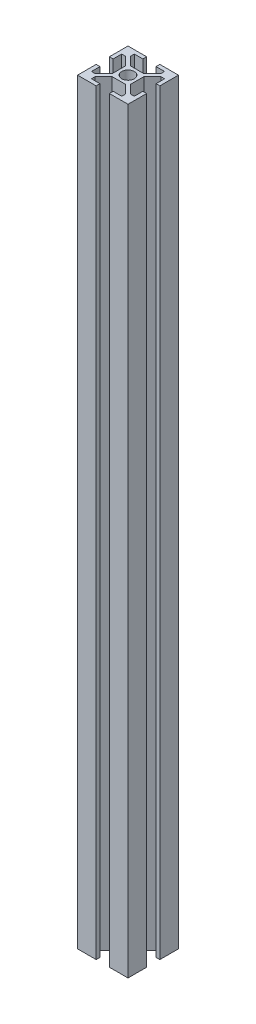
from build123d import *

# Parameters (mm, degrees)
SKETCH3_R           = 2.5
BOSS_EXTRUDE1_DEPTH = 300


with BuildPart() as part:
    # Sketch3 → Boss-Extrude1 (new body)
    with BuildSketch(Plane(origin=(0, 0, 0), x_dir=(1, 0, 0), z_dir=(0, 1, 0))):
        Polygon((2.594339828, 3.655), (6, 7.060660172), (6, 8.5), (2.63, 8.5), (2.63, 10), (10, 10), (10, 2.63), (8.5, 2.63), (8.5, 6), (7.060660172, 6), (3.655, 2.594339828), (3.655, 0), (3.655, -2.594339828), (7.060660172, -6), (8.5, -6), (8.5, -2.63), (10, -2.63), (10, -10), (2.63, -10), (2.63, -8.5), (6, -8.5), (6, -7.060660172), (2.594339828, -3.655), (0, -3.655), (-2.594339828, -3.655), (-6, -7.060660172), (-6, -8.5), (-2.63, -8.5), (-2.63, -10), (-10, -10), (-10, -2.63), (-8.5, -2.63), (-8.5, -6), (-7.060660172, -6), (-3.655, -2.594339828), (-3.655, 0), (-3.655, 2.594339828), (-7.060660172, 6), (-8.5, 6), (-8.5, 2.63), (-10, 2.63), (-10, 10), (-2.63, 10), (-2.63, 8.5), (-6, 8.5), (-6, 7.060660172), (-2.594339828, 3.655), (0, 3.655), align=None)
        Circle(SKETCH3_R, mode=Mode.SUBTRACT)
    extrude(amount=BOSS_EXTRUDE1_DEPTH)


solid = part.part
